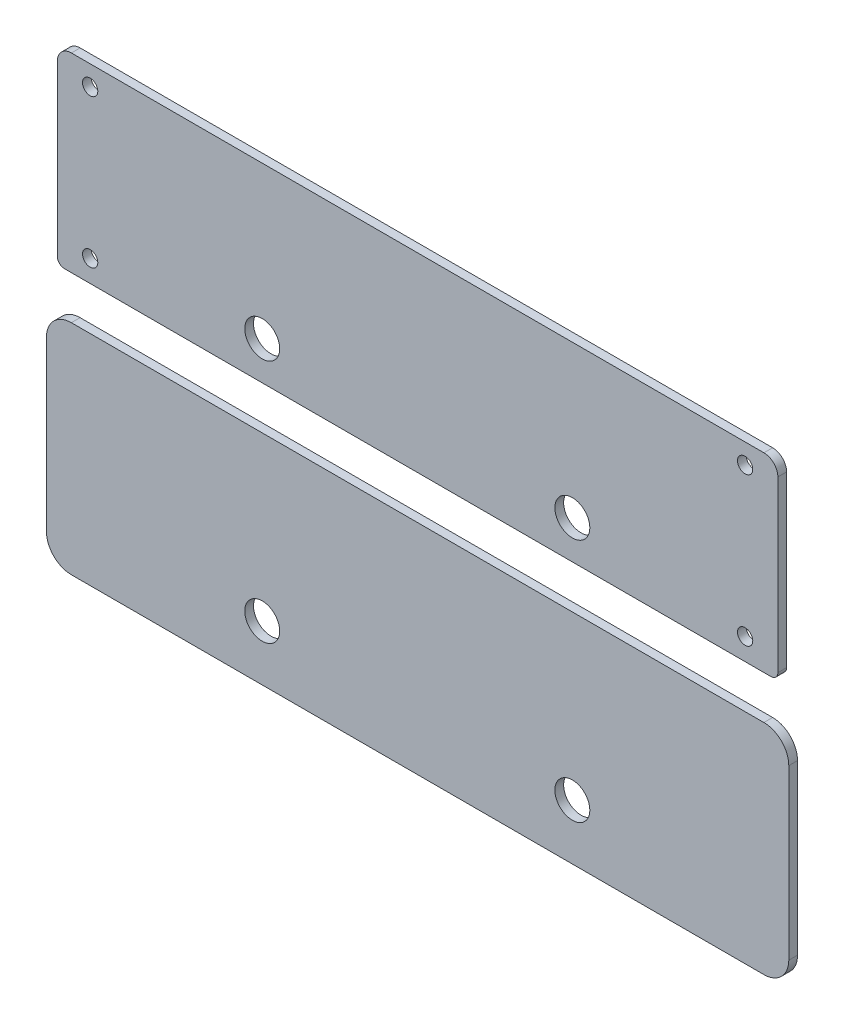
from build123d import *

# Parameters (mm, degrees)
SKETCH1_R             = 5.08
BOSS_EXTRUDE1_DEPTH   = 2.54
BOSS_EXTRUDE1_2_DEPTH = 2.54
SKETCH9_W             = 20
SKETCH9_H             = 6
BOSS_EXTRUDE4_DEPTH   = 2.54
FILLET1_R             = 2
SKETCH10_R            = 2.2225
CUT_EXTRUDE5_DEPTH    = 147.965122138


with BuildPart() as part:
    # Sketch1 → Boss-Extrude1 (new body)
    with BuildSketch(Plane.XY):
        with BuildLine():
            Line((-52.6295, -31.75), (-37.7705, -31.75))
            Line((-37.7705, -31.75), (37.5705, -31.75))
            Line((37.5705, -31.75), (52.4295, -31.75))
            Line((52.4295, -31.75), (100.711, -31.75))
            ThreePointArc((100.711, -31.75), (105.829745989, -29.629745989), (107.95, -24.511))
            Line((107.95, -24.511), (107.95, 24.511))
            ThreePointArc((107.95, 24.511), (105.829745989, 29.629745989), (100.711, 31.75))
            Line((100.711, 31.75), (-100.711, 31.75))
            ThreePointArc((-100.711, 31.75), (-105.829745989, 29.629745989), (-107.95, 24.511))
            Line((-107.95, 24.511), (-107.95, -24.511))
            ThreePointArc((-107.95, -24.511), (-105.829745989, -29.629745989), (-100.711, -31.75))
            Line((-100.711, -31.75), (-52.6295, -31.75))
        make_face()
        with Locations((-45.2, -15.6502)):
            Circle(SKETCH1_R, mode=Mode.SUBTRACT)
        with Locations((45, -15.6502)):
            Circle(SKETCH1_R, mode=Mode.SUBTRACT)
    extrude(amount=BOSS_EXTRUDE1_DEPTH)


with BuildPart() as body_2:
    # Sketch1 → Boss-Extrude1 2 (new body)
    with BuildSketch(Plane.XY):
        with BuildLine():
            Line((100.711, 99.695), (-100.711, 99.695))
            ThreePointArc((-100.711, 99.695), (-103.584681959, 98.504681959), (-104.775, 95.631))
            Line((-104.775, 95.631), (-104.775, 50.345))
            Line((-104.775, 50.345), (-84.775, 50.345))
            Line((-84.775, 50.345), (-84.775, 44.345))
            Line((-84.775, 44.345), (84.775, 44.345))
            Line((84.775, 44.345), (84.775, 50.345))
            Line((84.775, 50.345), (104.775, 50.345))
            Line((104.775, 50.345), (104.775, 95.631))
            ThreePointArc((104.775, 95.631), (103.584681959, 98.504681959), (100.711, 99.695))
        make_face()
        with Locations((-45.2, 55.4698)):
            Circle(SKETCH1_R, mode=Mode.SUBTRACT)
        with Locations((45, 55.4698)):
            Circle(SKETCH1_R, mode=Mode.SUBTRACT)
    extrude(amount=BOSS_EXTRUDE1_2_DEPTH)

    # Sketch9 → Boss-Extrude4 (add)
    with BuildSketch(Plane.XY.offset(2.54)):
        with Locations((-94.775, 47.345)):
            Rectangle(SKETCH9_W, SKETCH9_H)
        with Locations((94.775, 47.345)):
            Rectangle(SKETCH9_W, SKETCH9_H)
    extrude(amount=-BOSS_EXTRUDE4_DEPTH)

    # Fillet1
    fillet1_edges = [body_2.edges().sort_by_distance(p)[0] for p in [
        (-104.775, 44.345, 1.27),
        (104.775, 44.345, 1.27),
    ]]
    fillet(fillet1_edges, radius=FILLET1_R)

    # Sketch10 → Cut-Extrude5 (cut, through all)
    with BuildSketch(Plane.XY.offset(2.54)):
        with Locations((95.25, 93.87)):
            Circle(SKETCH10_R)
        with Locations((95.25, 50.69)):
            Circle(SKETCH10_R)
        with Locations((-95.25, 50.69)):
            Circle(SKETCH10_R)
        with Locations((-95.25, 93.87)):
            Circle(SKETCH10_R)
    extrude(amount=-CUT_EXTRUDE5_DEPTH, mode=Mode.SUBTRACT)


solid = Compound([part.part, body_2.part])
